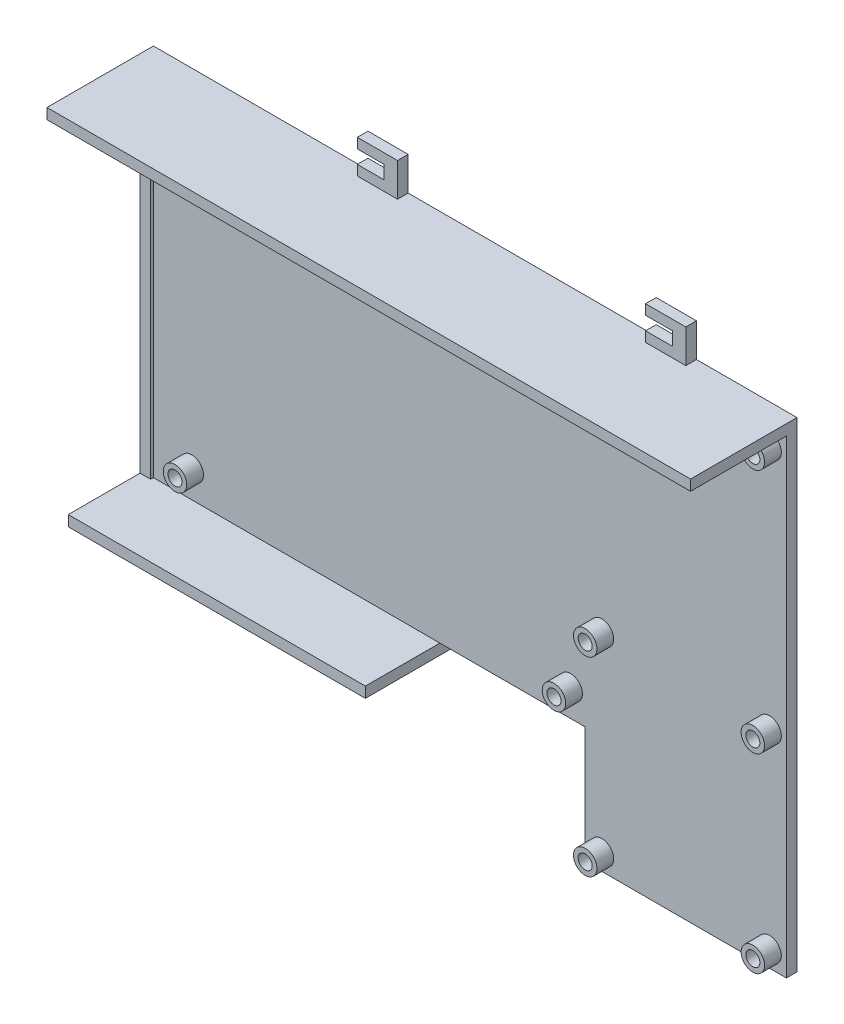
from build123d import *

# Parameters (mm, degrees)
SKETCH2_R              = 3.5
SKETCH2_R_2            = 2.0955
BOSS_EXTRUDE1_DEPTH    = 5
BOSS_EXTRUDE1_2_DEPTH  = 5
SKETCH2_R_3            = 2.1
BOSS_EXTRUDE1_3_DEPTH  = 5
BOSS_EXTRUDE1_4_DEPTH  = 5
BOSS_EXTRUDE1_5_DEPTH  = 5
BOSS_EXTRUDE1_6_DEPTH  = 5
BOSS_EXTRUDE1_7_DEPTH  = 5
BOSS_EXTRUDE1_8_DEPTH  = 5
BOSS_EXTRUDE1_9_DEPTH  = 5
BOSS_EXTRUDE1_10_DEPTH = 5
BOSS_EXTRUDE2_DEPTH    = 3.175
BOSS_EXTRUDE3_DEPTH    = 25.4
BOSS_EXTRUDE4_DEPTH    = 16
BOSS_EXTRUDE5_DEPTH    = 3.175
BOSS_EXTRUDE6_DEPTH    = 31.75
SKETCH4_5_W            = 3.175
SKETCH4_5_H            = 105.156
BOSS_EXTRUDE7_DEPTH    = 4
BOSS_EXTRUDE8_DEPTH    = 3.175


with BuildPart() as part:
    # Sketch2 → Boss-Extrude1 (new body)
    with BuildSketch(Plane(origin=(0, 0, 32.776775543), x_dir=(-1, 0, 0), z_dir=(0, 0, -1))):
        with Locations((46.17832863, 161.386626861)):
            Circle(SKETCH2_R)
        with Locations((46.17832863, 161.386626861)):
            Circle(SKETCH2_R_2, mode=Mode.SUBTRACT)
    extrude(amount=BOSS_EXTRUDE1_DEPTH)



with BuildPart() as body_2:
    # Sketch2 → Boss-Extrude1 2 (new body)
    with BuildSketch(Plane(origin=(0, 0, 32.776775543), x_dir=(-1, 0, 0), z_dir=(0, 0, -1))):
        with Locations((96.17832863, 161.386626861)):
            Circle(SKETCH2_R)
        with Locations((96.17832863, 161.386626861)):
            Circle(SKETCH2_R_2, mode=Mode.SUBTRACT)
    extrude(amount=BOSS_EXTRUDE1_2_DEPTH)


with BuildPart() as body_3:
    # Sketch2 → Boss-Extrude1 3 (new body)
    with BuildSketch(Plane(origin=(0, 0, 32.776775543), x_dir=(-1, 0, 0), z_dir=(0, 0, -1))):
        with Locations((105.49632863, 162.322626861)):
            Circle(SKETCH2_R)
        with Locations((105.49632863, 162.322626861)):
            Circle(SKETCH2_R_3, mode=Mode.SUBTRACT)
    extrude(amount=BOSS_EXTRUDE1_3_DEPTH)


with BuildPart() as body_4:
    # Sketch2 → Boss-Extrude1 4 (new body)
    with BuildSketch(Plane(origin=(0, 0, 32.776775543), x_dir=(-1, 0, 0), z_dir=(0, 0, -1))):
        with Locations((218.52632863, 162.322626861)):
            Circle(SKETCH2_R)
        with Locations((218.52632863, 162.322626861)):
            Circle(SKETCH2_R_3, mode=Mode.SUBTRACT)
    extrude(amount=BOSS_EXTRUDE1_4_DEPTH)


with BuildPart() as body_5:
    # Sketch2 → Boss-Extrude1 5 (new body)
    with BuildSketch(Plane(origin=(0, 0, 32.776775543), x_dir=(-1, 0, 0), z_dir=(0, 0, -1))):
        with Locations((46.17832863, 88.136626861)):
            Circle(SKETCH2_R)
        with Locations((46.17832863, 88.136626861)):
            Circle(SKETCH2_R_2, mode=Mode.SUBTRACT)
    extrude(amount=BOSS_EXTRUDE1_5_DEPTH)


with BuildPart() as body_6:
    # Sketch2 → Boss-Extrude1 6 (new body)
    with BuildSketch(Plane(origin=(0, 0, 32.776775543), x_dir=(-1, 0, 0), z_dir=(0, 0, -1))):
        with Locations((46.17832863, 31.386626861)):
            Circle(SKETCH2_R)
        with Locations((46.17832863, 31.386626861)):
            Circle(SKETCH2_R_2, mode=Mode.SUBTRACT)
    extrude(amount=BOSS_EXTRUDE1_6_DEPTH)


with BuildPart() as body_7:
    # Sketch2 → Boss-Extrude1 7 (new body)
    with BuildSketch(Plane(origin=(0, 0, 32.776775543), x_dir=(-1, 0, 0), z_dir=(0, 0, -1))):
        with Locations((96.17832863, 31.386626861)):
            Circle(SKETCH2_R)
        with Locations((96.17832863, 31.386626861)):
            Circle(SKETCH2_R_2, mode=Mode.SUBTRACT)
    extrude(amount=BOSS_EXTRUDE1_7_DEPTH)


with BuildPart() as body_8:
    # Sketch2 → Boss-Extrude1 8 (new body)
    with BuildSketch(Plane(origin=(0, 0, 32.776775543), x_dir=(-1, 0, 0), z_dir=(0, 0, -1))):
        with Locations((96.17832863, 88.136626861)):
            Circle(SKETCH2_R)
        with Locations((96.17832863, 88.136626861)):
            Circle(SKETCH2_R_2, mode=Mode.SUBTRACT)
    extrude(amount=BOSS_EXTRUDE1_8_DEPTH)


with BuildPart() as body_9:
    # Sketch2 → Boss-Extrude1 9 (new body)
    with BuildSketch(Plane(origin=(0, 0, 32.776775543), x_dir=(-1, 0, 0), z_dir=(0, 0, -1))):
        with Locations((105.49632863, 69.358626861)):
            Circle(SKETCH2_R)
        with Locations((105.49632863, 69.358626861)):
            Circle(SKETCH2_R_3, mode=Mode.SUBTRACT)
    extrude(amount=BOSS_EXTRUDE1_9_DEPTH)


with BuildPart() as body_10:
    # Sketch2 → Boss-Extrude1 10 (new body)
    with BuildSketch(Plane(origin=(0, 0, 32.776775543), x_dir=(-1, 0, 0), z_dir=(0, 0, -1))):
        with Locations((218.52632863, 69.358626861)):
            Circle(SKETCH2_R)
        with Locations((218.52632863, 69.358626861)):
            Circle(SKETCH2_R_3, mode=Mode.SUBTRACT)
    extrude(amount=BOSS_EXTRUDE1_10_DEPTH)


with BuildPart() as part_1:
    add(part.part)

    add(body_2.part)  # Boss-Extrude2 merges body 2

    add(body_3.part)  # Boss-Extrude2 merges body 3

    add(body_4.part)  # Boss-Extrude2 merges body 4

    add(body_5.part)  # Boss-Extrude2 merges body 5

    add(body_6.part)  # Boss-Extrude2 merges body 6

    add(body_7.part)  # Boss-Extrude2 merges body 7

    add(body_8.part)  # Boss-Extrude2 merges body 8

    add(body_9.part)  # Boss-Extrude2 merges body 9

    add(body_10.part)  # Boss-Extrude2 merges body 10
    # Sketch3 → Boss-Extrude2 (add)
    with BuildSketch(Plane(origin=(0, 0, 27.776775543), x_dir=(-1, 0, 0), z_dir=(0, 0, -1))):
        Polygon((41.17832863, 166.386626861), (229.95632863, 166.386626861), (229.95632863, 61.230626861), (101.17832863, 61.230626861), (101.17832863, 26.386626861), (41.17832863, 26.386626861), (41.17832863, 61.230626861), align=None)
    extrude(amount=BOSS_EXTRUDE2_DEPTH)

    # Sketch4 → Boss-Extrude3 (add)
    with BuildSketch(Plane(origin=(0, 0, 24.601775543), x_dir=(-1, 0, 0), z_dir=(0, 0, -1))):
        Polygon((233.13132863, 61.230626861), (229.95632863, 61.230626861), (144.520113107, 61.230626861), (144.520113107, 58.055626861), (233.13132863, 58.055626861), align=None)
    extrude(amount=-BOSS_EXTRUDE3_DEPTH)

    # Sketch4<3> → Boss-Extrude4 (add)
    with BuildSketch(Plane(origin=(0, 0, 24.601775543), x_dir=(-1, 0, 0), z_dir=(0, 0, -1))):
        Polygon((144.520113107, 61.230626861), (144.520113107, 58.055626861), (233.13132863, 58.055626861), (233.13132863, 61.230626861), (229.95632863, 61.230626861), align=None)
    extrude(amount=-BOSS_EXTRUDE4_DEPTH)

    # Sketch5 → Boss-Extrude5 (add)
    with BuildSketch(Plane(origin=(0, 0, 24.601775543), x_dir=(-1, 0, 0), z_dir=(0, 0, -1))):
        Polygon((166.051482846, 58.055626861), (166.051482846, 48.055626861), (178.051482846, 48.055626861), (178.051482846, 51.055626861), (170.051482846, 51.055626861), (170.051482846, 55.055626861), (178.051482846, 55.055626861), (178.051482846, 58.055626861), align=None)
    extrude(amount=-BOSS_EXTRUDE5_DEPTH)

    # Sketch4<4> → Boss-Extrude6 (add)
    with BuildSketch(Plane(origin=(0, 0, 24.601775543), x_dir=(-1, 0, 0), z_dir=(0, 0, -1))):
        Polygon((41.17832863, 169.561626861), (41.17832863, 166.386626861), (229.95632863, 166.386626861), (233.13132863, 166.386626861), (233.13132863, 169.561626861), align=None)
    extrude(amount=-BOSS_EXTRUDE6_DEPTH)

    # Sketch4<5> → Boss-Extrude7 (add)
    with BuildSketch(Plane(origin=(0, 0, 24.601775543), x_dir=(-1, 0, 0), z_dir=(0, 0, -1))):
        with Locations((231.54382863, 113.808626861)):
            Rectangle(SKETCH4_5_W, SKETCH4_5_H)
    extrude(amount=-BOSS_EXTRUDE7_DEPTH)

    # Sketch6 → Boss-Extrude8 (add)
    with BuildSketch(Plane(origin=(0, 0, 24.601775543), x_dir=(-1, 0, 0), z_dir=(0, 0, -1))):
        Polygon((157.15482863, 179.561626861), (157.15482863, 169.561626861), (169.15482863, 169.561626861), (169.15482863, 172.561626861), (161.15482863, 172.561626861), (161.15482863, 176.561626861), (169.15482863, 176.561626861), (169.15482863, 179.561626861), align=None)
        Polygon((71.17832863, 169.561626861), (83.17832863, 169.561626861), (83.17832863, 172.561626861), (75.17832863, 172.561626861), (75.17832863, 176.561626861), (83.17832863, 176.561626861), (83.17832863, 179.561626861), (71.17832863, 179.561626861), align=None)
    extrude(amount=-BOSS_EXTRUDE8_DEPTH)


solid = part_1.part
